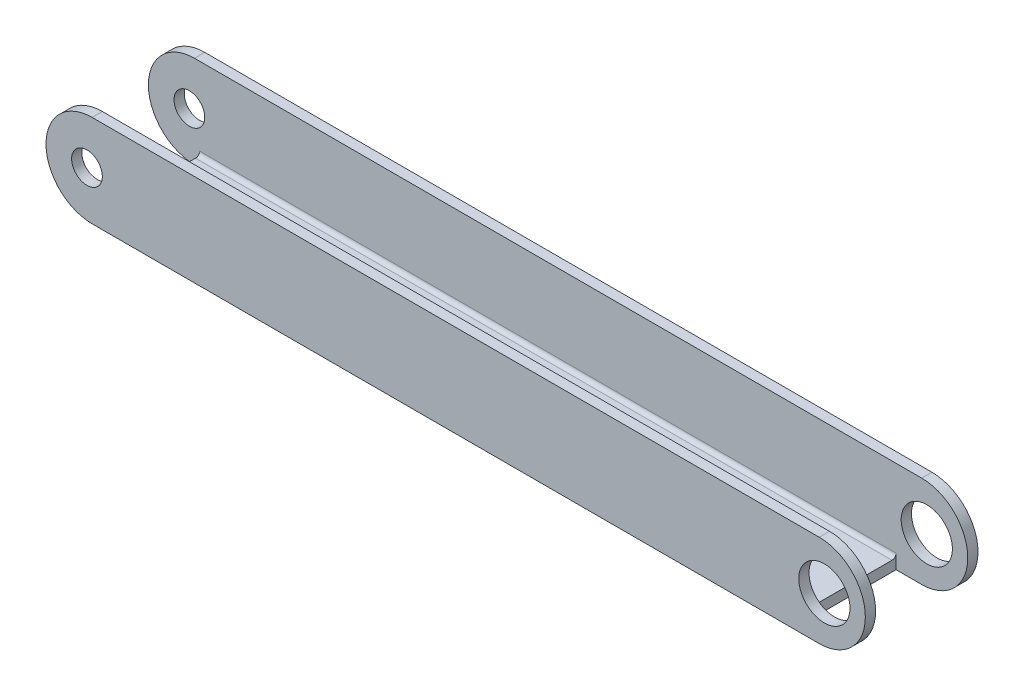
from build123d import *

# Parameters (mm, degrees)
EXTRUDE_THIN1_DEPTH     = 200
CUT_EXTRUDE1_DEPTH      = 206.80634101
CUT_EXTRUDE1_DEPTH_BACK = 206.80634101
SKETCH3_R               = 7.5
SKETCH3_R_2             = 12.5
SKETCH4_W               = 35
SKETCH4_H               = 45
CUT_EXTRUDE2_DEPTH      = 207.836287919
SKETCH5_W               = 25
SKETCH5_H               = 45
CUT_EXTRUDE3_DEPTH      = 207.836287919
FILLET1_RADIUS          = 22.5
FILLET1_LENGTH          = 5
FILLET2_RADIUS          = 22.5
FILLET2_LENGTH          = 5
FILLET3_R               = 2
FILLET4_RADIUS          = 22.5
FILLET4_LENGTH          = 5
FILLET5_RADIUS          = 22.5
FILLET5_LENGTH          = 5


with BuildPart() as part:
    # Sketch1 → Extrude-Thin1 (new, symmetric)
    with BuildSketch(Plane(origin=(0, 0, 0), x_dir=(0, 0, -1), z_dir=(1, 0, 0))):
        Polygon((-22.5, 40), (-22.5, 0), (22.5, 0), (22.5, 40), (27.5, 40), (27.5, -5), (-27.5, -5), (-27.5, 40), align=None)
    extrude(amount=EXTRUDE_THIN1_DEPTH, both=True)

    # Sketch3 → Cut-Extrude1 (cut, two sides: drawn at the far end of the back side and taken through both)
    with BuildSketch(Plane.XY.offset(-CUT_EXTRUDE1_DEPTH_BACK)):
        with Locations((-180, 17.5)):
            Circle(SKETCH3_R)
        with Locations((180, 17.5)):
            Circle(SKETCH3_R_2)
    extrude(amount=CUT_EXTRUDE1_DEPTH + CUT_EXTRUDE1_DEPTH_BACK, mode=Mode.SUBTRACT)

    # Sketch4 → Cut-Extrude2 (cut, through all)
    with BuildSketch(Plane(origin=(0, -5, 0), x_dir=(1, 0, 0), z_dir=(0, 1, 0))):
        with Locations((182.5, 0)):
            Rectangle(SKETCH4_W, SKETCH4_H)
    extrude(amount=CUT_EXTRUDE2_DEPTH, mode=Mode.SUBTRACT)

    # Sketch5 → Cut-Extrude3 (cut, through all)
    with BuildSketch(Plane(origin=(0, -5, 0), x_dir=(1, 0, 0), z_dir=(0, 1, 0))):
        with Locations((-187.5, 0)):
            Rectangle(SKETCH5_W, SKETCH5_H)
    extrude(amount=CUT_EXTRUDE3_DEPTH, mode=Mode.SUBTRACT)

    # Fillet1: full round fillet: the end face becomes a half cylinder, R = half its width
    fillet1_face = Plane((-200, 17.5, -25), x_dir=(0, 0, 1), z_dir=(-1, 0, 0))  # on the end face: x along it, z out of the body
    fillet1_slab = fillet1_face.offset(-FILLET1_RADIUS / 2) * Box(FILLET1_LENGTH, 2 * FILLET1_RADIUS, FILLET1_RADIUS, mode=Mode.PRIVATE)  # the body's end, R deep
    fillet1_round = Plane((-177.5, 17.5, -25), x_dir=(-1, 0, 0), z_dir=(0, 0, 1)) * Cylinder(FILLET1_RADIUS, FILLET1_LENGTH, mode=Mode.PRIVATE)  # its axis R under the face
    add(fillet1_slab - fillet1_round, mode=Mode.SUBTRACT)

    # Fillet2: full round fillet: the end face becomes a half cylinder, R = half its width
    fillet2_face = Plane((-200, 17.5, 25), x_dir=(0, 0, 1), z_dir=(-1, 0, 0))  # on the end face: x along it, z out of the body
    fillet2_slab = fillet2_face.offset(-FILLET2_RADIUS / 2) * Box(FILLET2_LENGTH, 2 * FILLET2_RADIUS, FILLET2_RADIUS, mode=Mode.PRIVATE)  # the body's end, R deep
    fillet2_round = Plane((-177.5, 17.5, 25), x_dir=(-1, 0, 0), z_dir=(0, 0, 1)) * Cylinder(FILLET2_RADIUS, FILLET2_LENGTH, mode=Mode.PRIVATE)  # its axis R under the face
    add(fillet2_slab - fillet2_round, mode=Mode.SUBTRACT)

    # Fillet3
    fillet3_edges = [part.edges().sort_by_distance(p)[0] for p in [
        (-5, 0, 22.5),
        (-5, 0, -22.5),
    ]]
    fillet(fillet3_edges, radius=FILLET3_R)

    # Fillet4: full round fillet: the end face becomes a half cylinder, R = half its width
    fillet4_face = Plane((200, 17.5, -25), x_dir=(0, 0, -1), z_dir=(1, 0, 0))  # on the end face: x along it, z out of the body
    fillet4_slab = fillet4_face.offset(-FILLET4_RADIUS / 2) * Box(FILLET4_LENGTH, 2 * FILLET4_RADIUS, FILLET4_RADIUS, mode=Mode.PRIVATE)  # the body's end, R deep
    fillet4_round = Plane((177.5, 17.5, -25), x_dir=(1, 0, 0), z_dir=(0, 0, -1)) * Cylinder(FILLET4_RADIUS, FILLET4_LENGTH, mode=Mode.PRIVATE)  # its axis R under the face
    add(fillet4_slab - fillet4_round, mode=Mode.SUBTRACT)

    # Fillet5: full round fillet: the end face becomes a half cylinder, R = half its width
    fillet5_face = Plane((200, 17.5, 25), x_dir=(0, 0, 1), z_dir=(1, 0, 0))  # on the end face: x along it, z out of the body
    fillet5_slab = fillet5_face.offset(-FILLET5_RADIUS / 2) * Box(FILLET5_LENGTH, 2 * FILLET5_RADIUS, FILLET5_RADIUS, mode=Mode.PRIVATE)  # the body's end, R deep
    fillet5_round = Plane((177.5, 17.5, 25), x_dir=(1, 0, 0), z_dir=(0, 0, 1)) * Cylinder(FILLET5_RADIUS, FILLET5_LENGTH, mode=Mode.PRIVATE)  # its axis R under the face
    add(fillet5_slab - fillet5_round, mode=Mode.SUBTRACT)


solid = part.part
